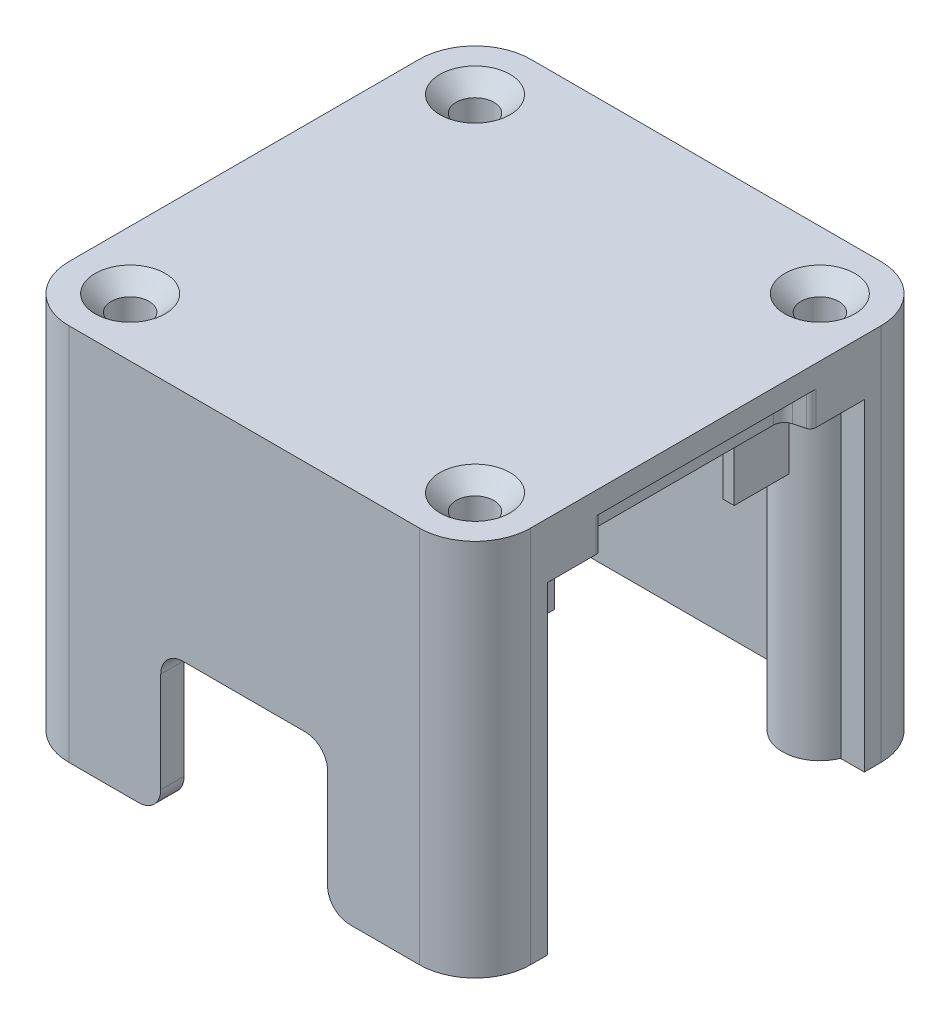
from build123d import *

# Parameters (mm, degrees)
SKETCH1_W                                       = 41.5
SKETCH1_H                                       = 41.5
BOSS_EXTRUDE1_DEPTH                             = 34
FILLET1_R                                       = 5
SHELL1_T                                        = -2.1
CUT_EXTRUDE1_REACH                              = 59.522
SKETCH2_W                                       = 15
SKETCH2_H                                       = 13
FILLET2_R                                       = 2
CUT_EXTRUDE2_REACH                              = 59.522
CUT_EXTRUDE3_REACH                              = 59.522
SKETCH4_W                                       = 28.5
SKETCH4_H                                       = 29
CUT_EXTRUDE6_DEPTH                              = 3
SKETCH6_W                                       = 1.9
SKETCH6_H                                       = 36.944263036
BOSS_EXTRUDE2_DEPTH                             = 2.9
SKETCH7_R                                       = 3.35
BOSS_EXTRUDE3_DEPTH                             = 31.9
SKETCH11_R                                      = 4.35
BOSS_EXTRUDE5_DEPTH                             = 1
CSK_FOR_M3_FLAT_HEAD_MACHINE_SCREW1_D           = 3.4
CSK_FOR_M3_FLAT_HEAD_MACHINE_SCREW1_CSINK_D     = 6.3
CSK_FOR_M3_FLAT_HEAD_MACHINE_SCREW1_CSINK_ANGLE = 90
SKETCH10_R                                      = 3
SKETCH10_R_2                                    = 1.325
BOSS_EXTRUDE4_DEPTH                             = 10
SKETCH13_W                                      = 3.462657938
SKETCH13_H                                      = 10.25
CUT_EXTRUDE5_DEPTH                              = 10
SKETCH12_W                                      = 35.4
SKETCH12_H                                      = 0.625
SKETCH12_W_2                                    = 24.075
SKETCH12_W_3                                    = 0.625
SKETCH12_H_2                                    = 37.3
EXTRUDE_THIN4_DEPTH                             = 2.9
FILLET3_R                                       = 1
FILLET4_R                                       = 0.5
EXTRUDE_THIN5_DEPTH                             = 10


with BuildPart() as part:
    # Sketch1 → Boss-Extrude1 (new body)
    with BuildSketch(Plane(origin=(0, 0, 0), x_dir=(1, 0, 0), z_dir=(0, 1, 0))):
        Rectangle(SKETCH1_W, SKETCH1_H)
    extrude(amount=-BOSS_EXTRUDE1_DEPTH)

    # Fillet1
    fillet1_edges = [part.edges().sort_by_distance(p)[0] for p in [
        (20.75, -17, 20.75),
        (-20.75, -17, 20.75),
        (-20.75, -17, -20.75),
        (20.75, -17, -20.75),
    ]]
    fillet(fillet1_edges, radius=FILLET1_R)

    # Shell1
    shell1_openings = [part.faces().sort_by_distance(p)[0] for p in [
        (0, -34, 0),
    ]]
    offset(amount=SHELL1_T, openings=shell1_openings, kind=Kind.INTERSECTION)

    # Sketch2 → Cut-Extrude1 (cut, up to next)
    with BuildSketch(Plane.XY.offset(20.75), mode=Mode.PRIVATE) as cut_extrude1_sk1:
        with Locations((0, -27.5)):
            Rectangle(SKETCH2_W, SKETCH2_H)
    cut_extrude1_tool1 = extrude(cut_extrude1_sk1.sketch, amount=-CUT_EXTRUDE1_REACH, mode=Mode.PRIVATE) & part.part
    add(cut_extrude1_tool1.solids().sort_by_distance((0, -27.5, 20.75))[0], mode=Mode.SUBTRACT)

    # Fillet2
    fillet2_edges = [part.edges().sort_by_distance(p)[0] for p in [
        (-7.5, -34, 19.7),
        (-7.5, -21, 19.7),
        (7.5, -21, 19.7),
        (7.5, -34, 19.7),
    ]]
    fillet(fillet2_edges, radius=FILLET2_R)

    # Sketch3 → Cut-Extrude2 (cut, up to next)
    with BuildSketch(Plane.ZY.offset(20.75), mode=Mode.PRIVATE) as cut_extrude2_sk1:
        Polygon((8.25, -5), (-8.25, -5), (-14.25, -26), (-14.25, -34), (14.25, -34), (14.25, -26), align=None)
    cut_extrude2_tool1 = extrude(cut_extrude2_sk1.sketch, amount=-CUT_EXTRUDE2_REACH, mode=Mode.PRIVATE) & part.part
    add(cut_extrude2_tool1.solids().sort_by_distance((-20.75, -20.849036, 0))[0], mode=Mode.SUBTRACT)

    # Sketch4 → Cut-Extrude3 (cut, up to next)
    with BuildSketch(Plane(origin=(20.75, 0, 0), x_dir=(0, 0, -1), z_dir=(1, 0, 0)), mode=Mode.PRIVATE) as cut_extrude3_sk1:
        with Locations((0, -19.5)):
            Rectangle(SKETCH4_W, SKETCH4_H)
    cut_extrude3_tool1 = extrude(cut_extrude3_sk1.sketch, amount=-CUT_EXTRUDE3_REACH, mode=Mode.PRIVATE) & part.part
    add(cut_extrude3_tool1.solids().sort_by_distance((20.75, -19.5, 0))[0], mode=Mode.SUBTRACT)

    # Sketch14 → Cut-Extrude6 (cut)
    with BuildSketch(Plane.XZ.offset(5)):
        Polygon((20.75, 9.5), (20.75, -9.5), (18.35, -8.856921938), (18.35, 8.856921938), align=None)
    extrude(amount=-CUT_EXTRUDE6_DEPTH, mode=Mode.SUBTRACT)

    # Sketch6 → Boss-Extrude2 (add)
    with BuildSketch(Plane.XZ.offset(5)):
        with Locations((17.7, 0)):
            Rectangle(SKETCH6_W, SKETCH6_H)
    extrude(amount=-BOSS_EXTRUDE2_DEPTH)

    # Sketch7 → Boss-Extrude3 (add)
    with BuildSketch(Plane.XZ.offset(2.1)):
        with Locations((-15.5, 15.5)):
            Circle(SKETCH7_R)
        with Locations((15.5, 15.5)):
            Circle(SKETCH7_R)
        with Locations((-15.5, -15.5)):
            Circle(SKETCH7_R)
        with Locations((15.5, -15.5)):
            Circle(SKETCH7_R)
    extrude(amount=BOSS_EXTRUDE3_DEPTH)

    # Sketch11 → Boss-Extrude5 (add)
    with BuildSketch(Plane.XZ.offset(2.1)):
        with Locations((15.5, 15.5)):
            Circle(SKETCH11_R)
        with Locations((-15.5, 15.5)):
            Circle(SKETCH11_R)
        with Locations((-15.5, -15.5)):
            Circle(SKETCH11_R)
        with Locations((15.5, -15.5)):
            Circle(SKETCH11_R)
    extrude(amount=BOSS_EXTRUDE5_DEPTH)

    # CSK for M3 Flat Head Machine Screw1 (through all)
    with Locations(Plane(origin=(0, 0, 0), x_dir=(1, 0, 0), z_dir=(0, 1, 0))):
        with Locations((-15.5, -15.5), (-15.5, 15.5), (15.5, -15.5), (15.5, 15.5)):
            CounterSinkHole(CSK_FOR_M3_FLAT_HEAD_MACHINE_SCREW1_D / 2, CSK_FOR_M3_FLAT_HEAD_MACHINE_SCREW1_CSINK_D / 2, counter_sink_angle=CSK_FOR_M3_FLAT_HEAD_MACHINE_SCREW1_CSINK_ANGLE)

    # Sketch10 → Boss-Extrude4 (add)
    # profile 1 of 2: a face of its own
    with BuildSketch(Plane.XZ.offset(2.1)):
        with Locations(Location((6.75, 7.575, 0), (0, 0, 90))):
            Circle(SKETCH10_R)
        with Locations(Location((6.75, 7.575, 0), (0, 0, 270))):
            Circle(SKETCH10_R_2, mode=Mode.SUBTRACT)
    # profile 2 of 2: a face of its own
    with BuildSketch(Plane.XZ.offset(2.1)):
        with Locations(Location((6.75, -7.575, 0), (0, 0, 90))):
            Circle(SKETCH10_R)
        with Locations(Location((6.75, -7.575, 0), (0, 0, 270))):
            Circle(SKETCH10_R_2, mode=Mode.SUBTRACT)
    extrude(amount=BOSS_EXTRUDE4_DEPTH)

    # Sketch13 → Cut-Extrude5 (cut)
    with BuildSketch(Plane.XZ.offset(12.1)):
        with Locations((6.75, 0)):
            Rectangle(SKETCH13_W, SKETCH13_H)
    extrude(amount=-CUT_EXTRUDE5_DEPTH, mode=Mode.SUBTRACT)

    # Sketch12 → Extrude-Thin4 (add)
    with BuildSketch(Plane.XZ.offset(2.1)):
        with Locations((-0.95, 0)):
            Rectangle(SKETCH12_W, SKETCH12_H)
        with Locations((-6.6125, 7.575)):
            Rectangle(SKETCH12_W_2, SKETCH12_H)
        with Locations((-6.6125, -7.575)):
            Rectangle(SKETCH12_W_2, SKETCH12_H)
        Rectangle(SKETCH12_W_3, SKETCH12_H_2)
        with Locations((-9.25, 0)):
            Rectangle(SKETCH12_W_3, SKETCH12_H_2)
        with Locations((9.25, 0)):
            Rectangle(SKETCH12_W_3, SKETCH12_H_2)
    extrude(amount=EXTRUDE_THIN4_DEPTH)

    # Fillet3
    fillet3_edges = [part.edges().sort_by_distance(p)[0] for p in [
        (18.65, -3.55, 8.937306696),
        (18.65, -3.55, -8.937306696),
    ]]
    fillet(fillet3_edges, radius=FILLET3_R)

    # Fillet4
    fillet4_edges = [part.edges().sort_by_distance(p)[0] for p in [
        (20.75, -3.5, -9.5),
        (20.75, -3.5, 9.5),
    ]]
    fillet(fillet4_edges, radius=FILLET4_R)

    # Sketch15 → Extrude-Thin5 (add)
    with BuildSketch(Plane.XZ.offset(2.1)):
        Polygon((16.05, 8.9), (16.05, 12.195457672), (16.05, 13.085443669), (15.05, 13.085443669), (15.05, 12.195457672), (15.05, 8.9), align=None)
        Polygon((16.05, -13.05900413), (16.05, -12.195457672), (16.05, -7.25), (15.05, -7.25), (15.05, -12.195457672), (15.05, -13.05900413), align=None)
    extrude(amount=EXTRUDE_THIN5_DEPTH)


solid = part.part
